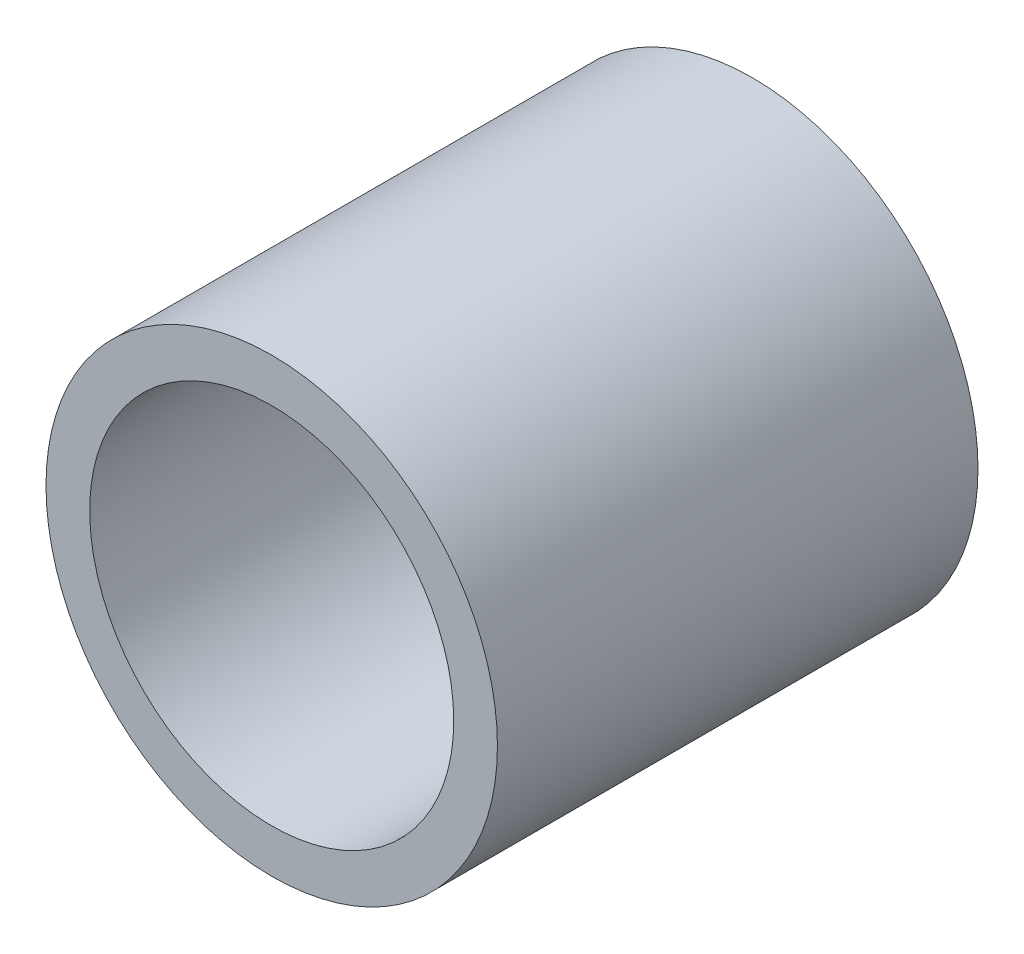
from build123d import *

# Parameters (mm, degrees)
SKETCH2_R           = 15.5
SKETCH2_R_2         = 12.5
BOSS_EXTRUDE1_DEPTH = 33


with BuildPart() as part:
    # Sketch2 → Boss-Extrude1 (new body)
    with BuildSketch(Plane.XY):
        Circle(SKETCH2_R)
        Circle(SKETCH2_R_2, mode=Mode.SUBTRACT)
    extrude(amount=BOSS_EXTRUDE1_DEPTH)


solid = part.part
